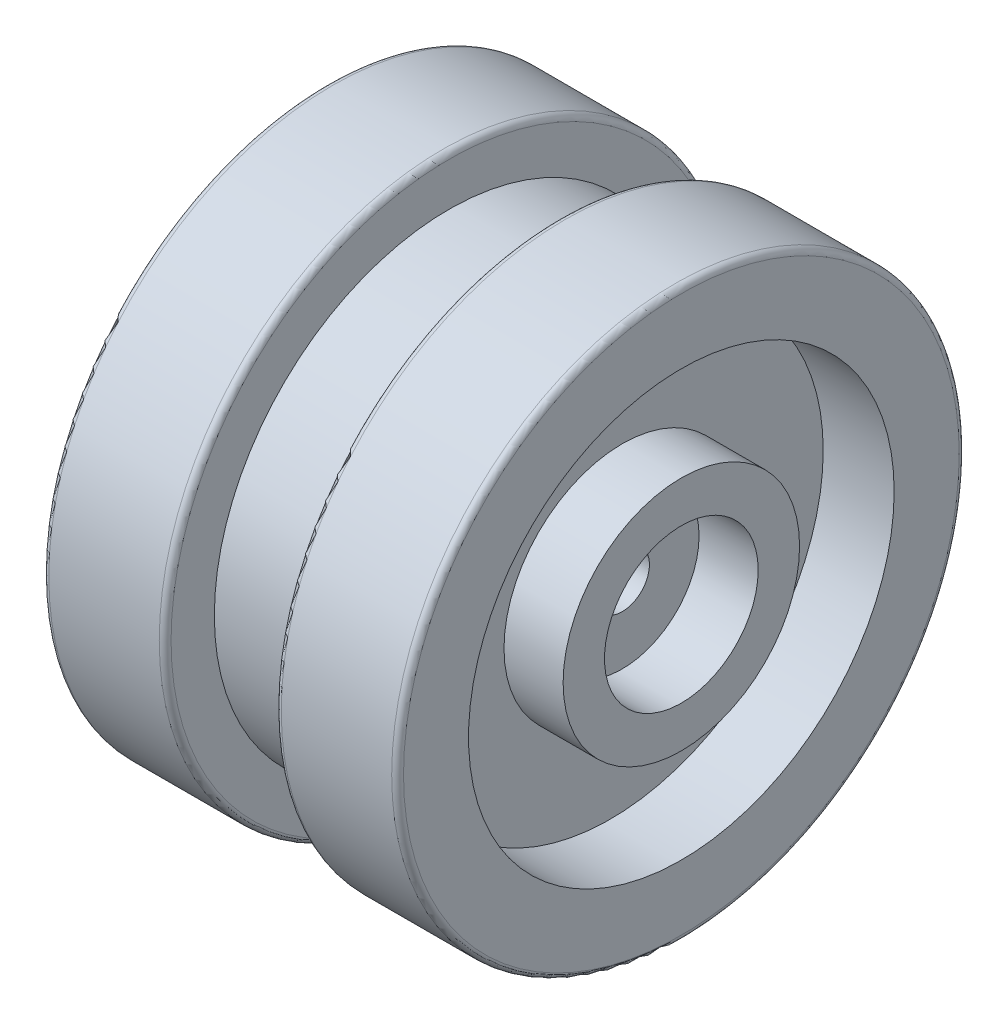
from build123d import *

# Parameters (mm, degrees)
SKETCH3_R           = 2
CUT_EXTRUDE1_DEPTH  = 58.27924924
FILLET2_R           = 0.5
SKETCH4_R           = 18
SKETCH4_R_2         = 6
CUT_EXTRUDE2_DEPTH  = 6
CUT_EXTRUDE3_START  = -6
SKETCH5_R           = 18
CUT_EXTRUDE3_DEPTH  = 6
SKETCH6_R           = 10
BOSS_EXTRUDE1_DEPTH = 6
SKETCH8_R           = 8
BOSS_EXTRUDE2_DEPTH = 10
SKETCH10_R          = 6.5
CUT_EXTRUDE5_DEPTH  = 5
SKETCH11_R          = 10
BOSS_EXTRUDE3_DEPTH = 5
CUT_EXTRUDE6_START  = -5
SKETCH12_R          = 6.5
CUT_EXTRUDE6_DEPTH  = 5
SKETCH7_R           = 2.3
CUT_EXTRUDE8_DEPTH  = 58.279249356


with BuildPart() as part:
    # Sketch2 → Revolve1 (revolve)
    with BuildSketch(Plane.XY, mode=Mode.PRIVATE) as revolve1_sk:
        Polygon((-2.085200875, 1.355739462), (7.234799125, 1.355739462), (7.234799125, 5.515739462), (17.574799125, 5.515739462), (17.574799125, -18.484260538), (-12.425200875, -18.484260538), (-12.425200875, 5.515739462), (-2.085200875, 5.515739462), align=None)
    revolve(revolve1_sk.sketch.rotate(Axis((-12.425200875, -18.484260538, 0), (1, 0, 0)), 90), axis=Axis((-12.425200875, -18.484260538, 0), (1, 0, 0)))

    # Sketch3 → Cut-Extrude1 (cut, through all)
    with BuildSketch(Plane(origin=(17.574799125, 0, 0), x_dir=(0, 0, -1), z_dir=(1, 0, 0))):
        with Locations((0, -18.484260538)):
            Circle(SKETCH3_R)
    extrude(amount=-CUT_EXTRUDE1_DEPTH, mode=Mode.SUBTRACT)

    # Fillet2
    fillet2_edges = [part.edges().sort_by_distance(p)[0] for p in [
        (-2.085200875, -18.484260538, -24),
        (7.234799125, -18.484260538, -24),
        (17.574799125, -18.484260538, -24),
        (-12.425200875, -18.484260538, -24),
    ]]
    fillet(fillet2_edges, radius=FILLET2_R)

    # Sketch4 → Cut-Extrude2 (cut)
    with BuildSketch(Plane(origin=(17.574799125, 0, 0), x_dir=(0, 0, -1), z_dir=(1, 0, 0))):
        with Locations((0, -18.484260538)):
            Circle(SKETCH4_R)
        with Locations((0, -18.484260538)):
            Circle(SKETCH4_R_2, mode=Mode.SUBTRACT)
    extrude(amount=-CUT_EXTRUDE2_DEPTH, mode=Mode.SUBTRACT)

    # Sketch5 → Cut-Extrude3 (cut)
    with BuildSketch(Plane.ZY.offset(12.425200875).offset(CUT_EXTRUDE3_START)):
        with Locations(Location((0, -18.484260538, 0), (0, 0, 180))):
            Circle(SKETCH5_R)
    extrude(amount=CUT_EXTRUDE3_DEPTH, mode=Mode.SUBTRACT)

    # Sketch6 → Boss-Extrude1 (add, through all)
    with BuildSketch(Plane.ZY.offset(6.425200875)):
        with Locations((0, -18.484260538)):
            Circle(SKETCH6_R)
    extrude(amount=BOSS_EXTRUDE1_DEPTH)

    # Sketch8 → Boss-Extrude2 (add)
    with BuildSketch(Plane(origin=(17.574799125, 0, 0), x_dir=(0, 0, -1), z_dir=(1, 0, 0))):
        with Locations((0, -18.484260538)):
            Circle(SKETCH8_R)
    extrude(amount=-BOSS_EXTRUDE2_DEPTH)

    # Sketch10 → Cut-Extrude5 (cut)
    with BuildSketch(Plane.ZY.offset(12.425200875)):
        with Locations((0, -18.484260538)):
            Circle(SKETCH10_R)
    extrude(amount=-CUT_EXTRUDE5_DEPTH, mode=Mode.SUBTRACT)

    # Sketch11 → Boss-Extrude3 (add)
    with BuildSketch(Plane(origin=(17.574799125, 0, 0), x_dir=(0, 0, -1), z_dir=(1, 0, 0))):
        with Locations(Location((0, -18.484260538, 0), (0, 0, 180))):
            Circle(SKETCH11_R)
    extrude(amount=-BOSS_EXTRUDE3_DEPTH)

    # Sketch12 → Cut-Extrude6 (cut)
    with BuildSketch(Plane(origin=(17.574799125, 0, 0), x_dir=(0, 0, -1), z_dir=(1, 0, 0)).offset(CUT_EXTRUDE6_START)):
        with Locations(Location((0, -18.484260538, 0), (0, 0, 180))):
            Circle(SKETCH12_R)
    extrude(amount=CUT_EXTRUDE6_DEPTH, mode=Mode.SUBTRACT)

    # Sketch7 → Cut-Extrude8 (cut, through all)
    with BuildSketch(Plane.ZY.offset(12.425200875)):
        with Locations((0, -18.484260538)):
            Circle(SKETCH7_R)
    extrude(amount=-CUT_EXTRUDE8_DEPTH, mode=Mode.SUBTRACT)


solid = part.part
